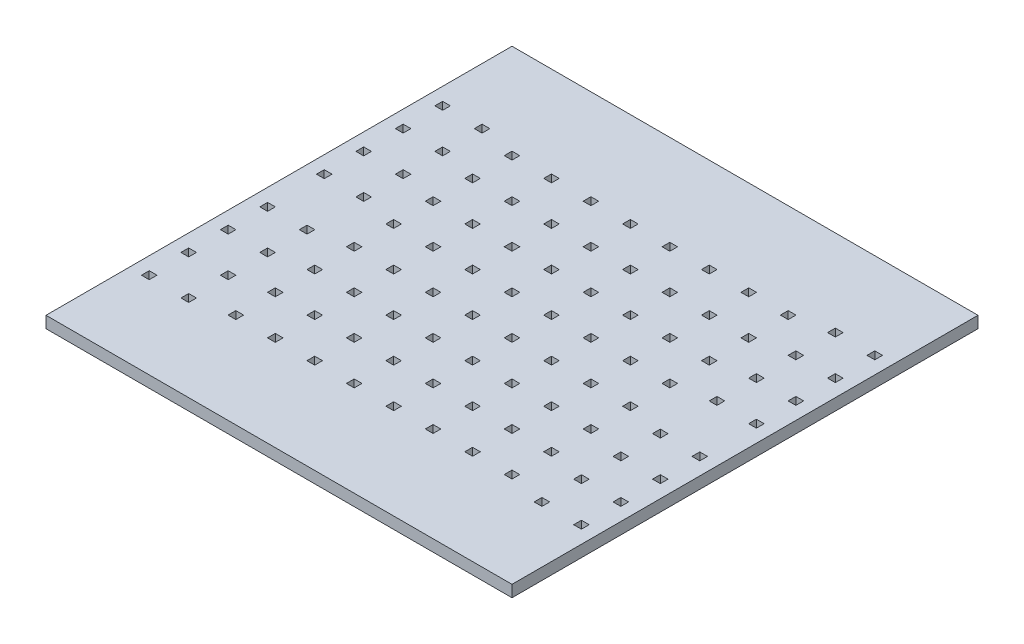
from build123d import *

# Parameters (mm, degrees)
SKETCH3_W               = 600
SKETCH3_H               = 600
BOSS_EXTRUDE1_DEPTH     = 15
SKETCH10_W              = 10
SKETCH10_H              = 10
CUT_EXTRUDE2_DEPTH      = 425.529150943
LPATTERN2_COUNT         = 8
LPATTERN2_PITCH         = 50.8
LPATTERN2_COUNT_DIR2    = 8
LPATTERN2_PITCH_DIR2    = 50.8
SKETCH13_W              = 10
SKETCH13_H              = 10
CUT_EXTRUDE3_DEPTH      = 425.529150943
LPATTERN3_COUNT         = 2
LPATTERN3_PITCH         = 50.8
LPATTERN3_COUNT_DIR2    = 4
LPATTERN3_PITCH_DIR2    = 50.8
MIRROR5_COPY_1_SKETCH_W = 10
MIRROR5_COPY_1_SKETCH_H = 10
MIRROR5_COPY_1_DEPTH    = 425.529150943
MIRROR5_COPY_2_SKETCH_W = 10
MIRROR5_COPY_2_SKETCH_H = 10
MIRROR5_COPY_2_DEPTH    = 425.529150943
MIRROR5_COPY_3_SKETCH_W = 10
MIRROR5_COPY_3_SKETCH_H = 10
MIRROR5_COPY_3_DEPTH    = 425.529150943
MIRROR5_COPY_4_SKETCH_W = 10
MIRROR5_COPY_4_SKETCH_H = 10
MIRROR5_COPY_4_DEPTH    = 425.529150943
MIRROR5_COPY_5_SKETCH_W = 10
MIRROR5_COPY_5_SKETCH_H = 10
MIRROR5_COPY_5_DEPTH    = 425.529150943
MIRROR5_COPY_6_SKETCH_W = 10
MIRROR5_COPY_6_SKETCH_H = 10
MIRROR5_COPY_6_DEPTH    = 425.529150943
MIRROR5_COPY_7_SKETCH_W = 10
MIRROR5_COPY_7_SKETCH_H = 10
MIRROR5_COPY_7_DEPTH    = 425.529150943
MIRROR6_COPY_1_SKETCH_W = 10
MIRROR6_COPY_1_SKETCH_H = 10
MIRROR6_COPY_1_DEPTH    = 425.529150943
MIRROR6_COPY_2_SKETCH_W = 10
MIRROR6_COPY_2_SKETCH_H = 10
MIRROR6_COPY_2_DEPTH    = 425.529150943
MIRROR6_COPY_3_SKETCH_W = 10
MIRROR6_COPY_3_SKETCH_H = 10
MIRROR6_COPY_3_DEPTH    = 425.529150943
MIRROR6_COPY_4_SKETCH_W = 10
MIRROR6_COPY_4_SKETCH_H = 10
MIRROR6_COPY_4_DEPTH    = 425.529150943
MIRROR6_COPY_5_SKETCH_W = 10
MIRROR6_COPY_5_SKETCH_H = 10
MIRROR6_COPY_5_DEPTH    = 425.529150943
MIRROR6_COPY_6_SKETCH_W = 10
MIRROR6_COPY_6_SKETCH_H = 10
MIRROR6_COPY_6_DEPTH    = 425.529150943
MIRROR6_COPY_7_SKETCH_W = 10
MIRROR6_COPY_7_SKETCH_H = 10
MIRROR6_COPY_7_DEPTH    = 425.529150943
MIRROR7_COPY_1_SKETCH_W = 10
MIRROR7_COPY_1_SKETCH_H = 10
MIRROR7_COPY_1_DEPTH    = 425.529150943
MIRROR7_COPY_2_SKETCH_W = 10
MIRROR7_COPY_2_SKETCH_H = 10
MIRROR7_COPY_2_DEPTH    = 425.529150943
MIRROR7_COPY_3_SKETCH_W = 10
MIRROR7_COPY_3_SKETCH_H = 10
MIRROR7_COPY_3_DEPTH    = 425.529150943
MIRROR7_COPY_4_SKETCH_W = 10
MIRROR7_COPY_4_SKETCH_H = 10
MIRROR7_COPY_4_DEPTH    = 425.529150943
MIRROR7_COPY_5_SKETCH_W = 10
MIRROR7_COPY_5_SKETCH_H = 10
MIRROR7_COPY_5_DEPTH    = 425.529150943
MIRROR7_COPY_6_SKETCH_W = 10
MIRROR7_COPY_6_SKETCH_H = 10
MIRROR7_COPY_6_DEPTH    = 425.529150943
MIRROR7_COPY_7_SKETCH_W = 10
MIRROR7_COPY_7_SKETCH_H = 10
MIRROR7_COPY_7_DEPTH    = 425.529150943
MIRROR7_COPY_8_SKETCH_W = 10
MIRROR7_COPY_8_SKETCH_H = 10
MIRROR7_COPY_8_DEPTH    = 425.529150943
MIRROR7_COPY_9_SKETCH_W = 10
MIRROR7_COPY_9_SKETCH_H = 10
MIRROR7_COPY_9_DEPTH    = 425.529150943


with BuildPart() as part:
    # Sketch3 → Boss-Extrude1 (new body)
    with BuildSketch(Plane(origin=(0, 0, 0), x_dir=(1, 0, 0), z_dir=(0, 1, 0))):
        Rectangle(SKETCH3_W, SKETCH3_H)
    extrude(amount=BOSS_EXTRUDE1_DEPTH)

    # Sketch10 → Cut-Extrude2 (cut, through all)
    with BuildSketch(Plane(origin=(0, 0, 0), x_dir=(1, 0, 0), z_dir=(0, 1, 0))):
        with Locations((-178, 178)):
            Rectangle(SKETCH10_W, SKETCH10_H)
    cut_extrude2 = extrude(amount=CUT_EXTRUDE2_DEPTH, mode=Mode.SUBTRACT)

    # LPattern2: Cut-Extrude2 8 × 8
    with Locations(*[(i * LPATTERN2_PITCH, 0, j * LPATTERN2_PITCH_DIR2) for i in range(LPATTERN2_COUNT) for j in range(LPATTERN2_COUNT_DIR2) if (i, j) != (0, 0)]):
        add(cut_extrude2, mode=Mode.SUBTRACT)

    # Sketch13 → Cut-Extrude3 (cut, through all)
    with BuildSketch(Plane(origin=(0, 15, 0), x_dir=(1, 0, 0), z_dir=(0, 1, 0))):
        with Locations((-227.416416512, -188.85974948)):
            Rectangle(SKETCH13_W, SKETCH13_H)
    cut_extrude3 = extrude(amount=-CUT_EXTRUDE3_DEPTH, mode=Mode.SUBTRACT)

    # LPattern3: Cut-Extrude3 2 × 4
    with Locations(*[(-i * LPATTERN3_PITCH, 0, -j * LPATTERN3_PITCH_DIR2) for i in range(LPATTERN3_COUNT) for j in range(LPATTERN3_COUNT_DIR2) if (i, j) != (0, 0)]):
        add(cut_extrude3, mode=Mode.SUBTRACT)

    # Mirror5: Cut-Extrude3 across plane
    add(cut_extrude3.mirror(Plane(origin=(0, 0, 0), x_dir=(0, 0, 1), z_dir=(1, 0, 0))), mode=Mode.SUBTRACT)

    # Mirror5 copy 1 sketch → Mirror5 copy 1 (cut, through all)
    with BuildSketch(Plane(origin=(0, 15, -50.8), x_dir=(-1, 0, 0), z_dir=(0, 1, 0))):
        with Locations((-227.416416512, 188.85974948)):
            Rectangle(MIRROR5_COPY_1_SKETCH_W, MIRROR5_COPY_1_SKETCH_H)
    extrude(amount=-MIRROR5_COPY_1_DEPTH, mode=Mode.SUBTRACT)

    # Mirror5 copy 2 sketch → Mirror5 copy 2 (cut, through all)
    with BuildSketch(Plane(origin=(0, 15, -101.6), x_dir=(-1, 0, 0), z_dir=(0, 1, 0))):
        with Locations((-227.416416512, 188.85974948)):
            Rectangle(MIRROR5_COPY_2_SKETCH_W, MIRROR5_COPY_2_SKETCH_H)
    extrude(amount=-MIRROR5_COPY_2_DEPTH, mode=Mode.SUBTRACT)

    # Mirror5 copy 3 sketch → Mirror5 copy 3 (cut, through all)
    with BuildSketch(Plane(origin=(0, 15, -152.4), x_dir=(-1, 0, 0), z_dir=(0, 1, 0))):
        with Locations((-227.416416512, 188.85974948)):
            Rectangle(MIRROR5_COPY_3_SKETCH_W, MIRROR5_COPY_3_SKETCH_H)
    extrude(amount=-MIRROR5_COPY_3_DEPTH, mode=Mode.SUBTRACT)

    # Mirror5 copy 4 sketch → Mirror5 copy 4 (cut, through all)
    with BuildSketch(Plane(origin=(50.8, 15, 0), x_dir=(-1, 0, 0), z_dir=(0, 1, 0))):
        with Locations((-227.416416512, 188.85974948)):
            Rectangle(MIRROR5_COPY_4_SKETCH_W, MIRROR5_COPY_4_SKETCH_H)
    extrude(amount=-MIRROR5_COPY_4_DEPTH, mode=Mode.SUBTRACT)

    # Mirror5 copy 5 sketch → Mirror5 copy 5 (cut, through all)
    with BuildSketch(Plane(origin=(50.8, 15, -50.8), x_dir=(-1, 0, 0), z_dir=(0, 1, 0))):
        with Locations((-227.416416512, 188.85974948)):
            Rectangle(MIRROR5_COPY_5_SKETCH_W, MIRROR5_COPY_5_SKETCH_H)
    extrude(amount=-MIRROR5_COPY_5_DEPTH, mode=Mode.SUBTRACT)

    # Mirror5 copy 6 sketch → Mirror5 copy 6 (cut, through all)
    with BuildSketch(Plane(origin=(50.8, 15, -101.6), x_dir=(-1, 0, 0), z_dir=(0, 1, 0))):
        with Locations((-227.416416512, 188.85974948)):
            Rectangle(MIRROR5_COPY_6_SKETCH_W, MIRROR5_COPY_6_SKETCH_H)
    extrude(amount=-MIRROR5_COPY_6_DEPTH, mode=Mode.SUBTRACT)

    # Mirror5 copy 7 sketch → Mirror5 copy 7 (cut, through all)
    with BuildSketch(Plane(origin=(50.8, 15, -152.4), x_dir=(-1, 0, 0), z_dir=(0, 1, 0))):
        with Locations((-227.416416512, 188.85974948)):
            Rectangle(MIRROR5_COPY_7_SKETCH_W, MIRROR5_COPY_7_SKETCH_H)
    extrude(amount=-MIRROR5_COPY_7_DEPTH, mode=Mode.SUBTRACT)

    # Mirror6: Cut-Extrude3 across plane
    add(cut_extrude3.mirror(Plane(origin=(0, 0, 0), x_dir=(1, 0, 0), z_dir=(0, 0, -1))), mode=Mode.SUBTRACT)

    # Mirror6 copy 1 sketch → Mirror6 copy 1 (cut, through all)
    with BuildSketch(Plane(origin=(0, 15, 50.8), x_dir=(1, 0, 0), z_dir=(0, 1, 0))):
        with Locations((-227.416416512, 188.85974948)):
            Rectangle(MIRROR6_COPY_1_SKETCH_W, MIRROR6_COPY_1_SKETCH_H)
    extrude(amount=-MIRROR6_COPY_1_DEPTH, mode=Mode.SUBTRACT)

    # Mirror6 copy 2 sketch → Mirror6 copy 2 (cut, through all)
    with BuildSketch(Plane(origin=(0, 15, 101.6), x_dir=(1, 0, 0), z_dir=(0, 1, 0))):
        with Locations((-227.416416512, 188.85974948)):
            Rectangle(MIRROR6_COPY_2_SKETCH_W, MIRROR6_COPY_2_SKETCH_H)
    extrude(amount=-MIRROR6_COPY_2_DEPTH, mode=Mode.SUBTRACT)

    # Mirror6 copy 3 sketch → Mirror6 copy 3 (cut, through all)
    with BuildSketch(Plane(origin=(0, 15, 152.4), x_dir=(1, 0, 0), z_dir=(0, 1, 0))):
        with Locations((-227.416416512, 188.85974948)):
            Rectangle(MIRROR6_COPY_3_SKETCH_W, MIRROR6_COPY_3_SKETCH_H)
    extrude(amount=-MIRROR6_COPY_3_DEPTH, mode=Mode.SUBTRACT)

    # Mirror6 copy 4 sketch → Mirror6 copy 4 (cut, through all)
    with BuildSketch(Plane(origin=(-50.8, 15, 0), x_dir=(1, 0, 0), z_dir=(0, 1, 0))):
        with Locations((-227.416416512, 188.85974948)):
            Rectangle(MIRROR6_COPY_4_SKETCH_W, MIRROR6_COPY_4_SKETCH_H)
    extrude(amount=-MIRROR6_COPY_4_DEPTH, mode=Mode.SUBTRACT)

    # Mirror6 copy 5 sketch → Mirror6 copy 5 (cut, through all)
    with BuildSketch(Plane(origin=(-50.8, 15, 50.8), x_dir=(1, 0, 0), z_dir=(0, 1, 0))):
        with Locations((-227.416416512, 188.85974948)):
            Rectangle(MIRROR6_COPY_5_SKETCH_W, MIRROR6_COPY_5_SKETCH_H)
    extrude(amount=-MIRROR6_COPY_5_DEPTH, mode=Mode.SUBTRACT)

    # Mirror6 copy 6 sketch → Mirror6 copy 6 (cut, through all)
    with BuildSketch(Plane(origin=(-50.8, 15, 101.6), x_dir=(1, 0, 0), z_dir=(0, 1, 0))):
        with Locations((-227.416416512, 188.85974948)):
            Rectangle(MIRROR6_COPY_6_SKETCH_W, MIRROR6_COPY_6_SKETCH_H)
    extrude(amount=-MIRROR6_COPY_6_DEPTH, mode=Mode.SUBTRACT)

    # Mirror6 copy 7 sketch → Mirror6 copy 7 (cut, through all)
    with BuildSketch(Plane(origin=(-50.8, 15, 152.4), x_dir=(1, 0, 0), z_dir=(0, 1, 0))):
        with Locations((-227.416416512, 188.85974948)):
            Rectangle(MIRROR6_COPY_7_SKETCH_W, MIRROR6_COPY_7_SKETCH_H)
    extrude(amount=-MIRROR6_COPY_7_DEPTH, mode=Mode.SUBTRACT)

    # Mirror7 copy 1 sketch → Mirror7 copy 1 (cut, through all)
    with BuildSketch(Plane(origin=(0, 15, 0), x_dir=(-1, 0, 0), z_dir=(0, 1, 0))):
        with Locations((-227.416416512, -188.85974948)):
            Rectangle(MIRROR7_COPY_1_SKETCH_W, MIRROR7_COPY_1_SKETCH_H)
    extrude(amount=-MIRROR7_COPY_1_DEPTH, mode=Mode.SUBTRACT)

    # Mirror7 copy 2 sketch → Mirror7 copy 2 (cut, through all)
    with BuildSketch(Plane(origin=(0, 15, 50.8), x_dir=(-1, 0, 0), z_dir=(0, 1, 0))):
        with Locations((-227.416416512, -188.85974948)):
            Rectangle(MIRROR7_COPY_2_SKETCH_W, MIRROR7_COPY_2_SKETCH_H)
    extrude(amount=-MIRROR7_COPY_2_DEPTH, mode=Mode.SUBTRACT)

    # Mirror7 copy 3 sketch → Mirror7 copy 3 (cut, through all)
    with BuildSketch(Plane(origin=(0, 15, 101.6), x_dir=(-1, 0, 0), z_dir=(0, 1, 0))):
        with Locations((-227.416416512, -188.85974948)):
            Rectangle(MIRROR7_COPY_3_SKETCH_W, MIRROR7_COPY_3_SKETCH_H)
    extrude(amount=-MIRROR7_COPY_3_DEPTH, mode=Mode.SUBTRACT)

    # Mirror7 copy 4 sketch → Mirror7 copy 4 (cut, through all)
    with BuildSketch(Plane(origin=(0, 15, 152.4), x_dir=(-1, 0, 0), z_dir=(0, 1, 0))):
        with Locations((-227.416416512, -188.85974948)):
            Rectangle(MIRROR7_COPY_4_SKETCH_W, MIRROR7_COPY_4_SKETCH_H)
    extrude(amount=-MIRROR7_COPY_4_DEPTH, mode=Mode.SUBTRACT)

    # Mirror7 copy 5 sketch → Mirror7 copy 5 (cut, through all)
    with BuildSketch(Plane(origin=(50.8, 15, 0), x_dir=(-1, 0, 0), z_dir=(0, 1, 0))):
        with Locations((-227.416416512, -188.85974948)):
            Rectangle(MIRROR7_COPY_5_SKETCH_W, MIRROR7_COPY_5_SKETCH_H)
    extrude(amount=-MIRROR7_COPY_5_DEPTH, mode=Mode.SUBTRACT)

    # Mirror7 copy 6 sketch → Mirror7 copy 6 (cut, through all)
    with BuildSketch(Plane(origin=(50.8, 15, 50.8), x_dir=(-1, 0, 0), z_dir=(0, 1, 0))):
        with Locations((-227.416416512, -188.85974948)):
            Rectangle(MIRROR7_COPY_6_SKETCH_W, MIRROR7_COPY_6_SKETCH_H)
    extrude(amount=-MIRROR7_COPY_6_DEPTH, mode=Mode.SUBTRACT)

    # Mirror7 copy 7 sketch → Mirror7 copy 7 (cut, through all)
    with BuildSketch(Plane(origin=(50.8, 15, 101.6), x_dir=(-1, 0, 0), z_dir=(0, 1, 0))):
        with Locations((-227.416416512, -188.85974948)):
            Rectangle(MIRROR7_COPY_7_SKETCH_W, MIRROR7_COPY_7_SKETCH_H)
    extrude(amount=-MIRROR7_COPY_7_DEPTH, mode=Mode.SUBTRACT)

    # Mirror7 copy 8 sketch → Mirror7 copy 8 (cut, through all)
    with BuildSketch(Plane(origin=(50.8, 15, 152.4), x_dir=(-1, 0, 0), z_dir=(0, 1, 0))):
        with Locations((-227.416416512, -188.85974948)):
            Rectangle(MIRROR7_COPY_8_SKETCH_W, MIRROR7_COPY_8_SKETCH_H)
    extrude(amount=-MIRROR7_COPY_8_DEPTH, mode=Mode.SUBTRACT)

    # Mirror7 copy 9 sketch → Mirror7 copy 9 (cut, through all)
    with BuildSketch(Plane(origin=(0, 15, 0), x_dir=(1, 0, 0), z_dir=(0, 1, 0))):
        with Locations((-227.416416512, 188.85974948)):
            Rectangle(MIRROR7_COPY_9_SKETCH_W, MIRROR7_COPY_9_SKETCH_H)
    extrude(amount=-MIRROR7_COPY_9_DEPTH, mode=Mode.SUBTRACT)


solid = part.part
